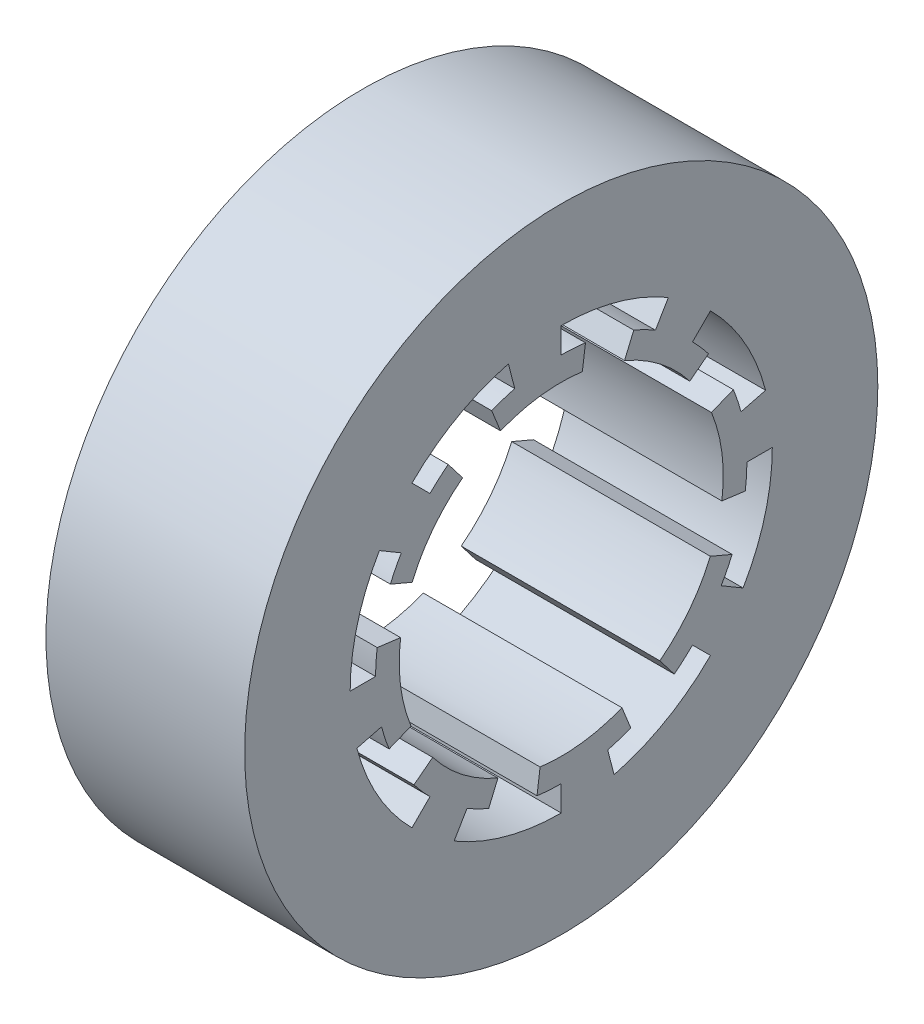
from build123d import *

# Parameters (mm, degrees)
SKETCH1_R           = 32.385
SKETCH1_R_2         = 21.59
BOSS_EXTRUDE1_DEPTH = 20.32
BOSS_EXTRUDE2_DEPTH = 20.32
CIRPATTERN1_COUNT   = 8


with BuildPart() as part:
    # Sketch1 → Boss-Extrude1 (new body)
    with BuildSketch(Plane.YZ):
        with Locations(Location((0, 0, 0), (0, 0, 270))):
            Circle(SKETCH1_R)
        with Locations(Location((0, 0, 0), (0, 0, 270))):
            Circle(SKETCH1_R_2, mode=Mode.SUBTRACT)
    extrude(amount=BOSS_EXTRUDE1_DEPTH)

    # Sketch3 → Boss-Extrude2 (add)
    with BuildSketch(Plane.YZ):
        with BuildLine():
            Line((-5.405704288, 20.902307556), (-4.753839947, 18.381735174))
            ThreePointArc((-4.753839947, 18.381735174), (-5.945884612, 18.03146246), (-7.112468086, 17.603976255))
            Line((-7.112468086, 17.603976255), (-6.208542376, 15.366681614))
            ThreePointArc((-6.208542376, 15.366681614), (-2.091558615, 16.440994034), (2.163275847, 16.43171141))
            Line((2.163275847, 16.43171141), (2.478235549, 18.82406786))
            ThreePointArc((2.478235549, 18.82406786), (1.241776513, 18.945848446), (0, 18.9865))
            Line((0, 18.9865), (0, 21.59))
            ThreePointArc((0, 21.59), (-2.724635744, 21.417386864), (-5.405704288, 20.902307556))
        make_face()
    boss_extrude2 = extrude(amount=BOSS_EXTRUDE2_DEPTH)

    # CirPattern1: Boss-Extrude2 ×8 about axis
    cirpattern1_axis = Axis((0, 0, 0), (1, 0, 0))
    for i in range(1, CIRPATTERN1_COUNT):
        add(boss_extrude2.rotate(cirpattern1_axis, i * 360 / CIRPATTERN1_COUNT))


solid = part.part
